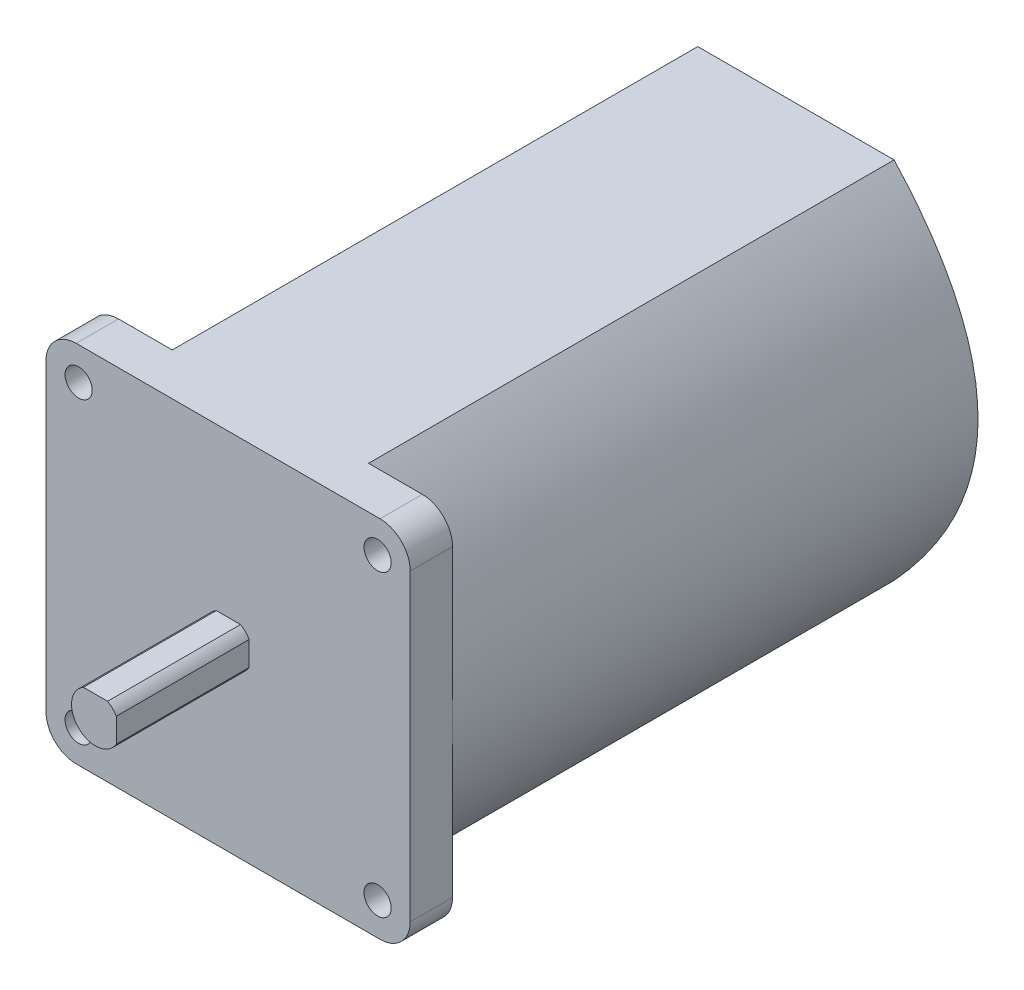
from build123d import *

# Parameters (mm, degrees)
BOSS_EXTRUDE1_DEPTH = 87
SKETCH2_R           = 2.25
BOSS_EXTRUDE2_DEPTH = 7
BOSS_EXTRUDE3_DEPTH = 22


with BuildPart() as part:
    # Sketch1 → Boss-Extrude1 (new body)
    with BuildSketch(Plane.XY):
        with BuildLine():
            Line((0, 0), (32.5, 0))
            add(Edge.make_bspline(
                [(32.5, 60.3), (60.3, 30.15), (32.5, 0)],
                knots=[0, 0, 0, 1, 1, 1], degree=2))
            Line((32.5, 60.3), (0, 60.3))
            add(Edge.make_bspline(
                [(0, 60.3), (-27.8, 30.15), (0, 0)],
                knots=[0, 0, 0, 1, 1, 1], degree=2))
        make_face()
    extrude(amount=BOSS_EXTRUDE1_DEPTH)

    # Sketch2 → Boss-Extrude2 (add)
    with BuildSketch(Plane.XY.offset(87)):
        with BuildLine():
            Line((-13.9, 55.3), (-13.9, 5))
            ThreePointArc((-13.9, 5), (-12.435533906, 1.464466094), (-8.9, 0))
            Line((-8.9, 0), (41.4, 0))
            ThreePointArc((41.4, 0), (44.935533906, 1.464466094), (46.4, 5))
            Line((46.4, 5), (46.4, 55.3))
            ThreePointArc((46.4, 55.3), (44.935533906, 58.835533906), (41.4, 60.3))
            Line((41.4, 60.3), (-8.9, 60.3))
            ThreePointArc((-8.9, 60.3), (-12.435533906, 58.835533906), (-13.9, 55.3))
        make_face()
        with Locations((40.998737342, 54.898737342)):
            Circle(SKETCH2_R, mode=Mode.SUBTRACT)
        with Locations((40.998737342, 5.401262658)):
            Circle(SKETCH2_R, mode=Mode.SUBTRACT)
        with Locations((-8.498737342, 5.401262658)):
            Circle(SKETCH2_R, mode=Mode.SUBTRACT)
        with Locations((-8.498737342, 54.898737342)):
            Circle(SKETCH2_R, mode=Mode.SUBTRACT)
    extrude(amount=BOSS_EXTRUDE2_DEPTH)

    # Sketch3 → Boss-Extrude3 (add)
    with BuildSketch(Plane.XY.offset(94)):
        with BuildLine():
            Line((18.300133509, 33.585203779), (14.300133509, 33.585203779))
            ThreePointArc((14.300133509, 33.585203779), (13.489384054, 27.339250545), (19.735337287, 28.15))
            Line((19.735337287, 28.15), (19.735337287, 32.15))
            ThreePointArc((19.735337287, 32.15), (19.110882964, 32.960749455), (18.300133509, 33.585203779))
        make_face()
    extrude(amount=BOSS_EXTRUDE3_DEPTH)


solid = part.part
